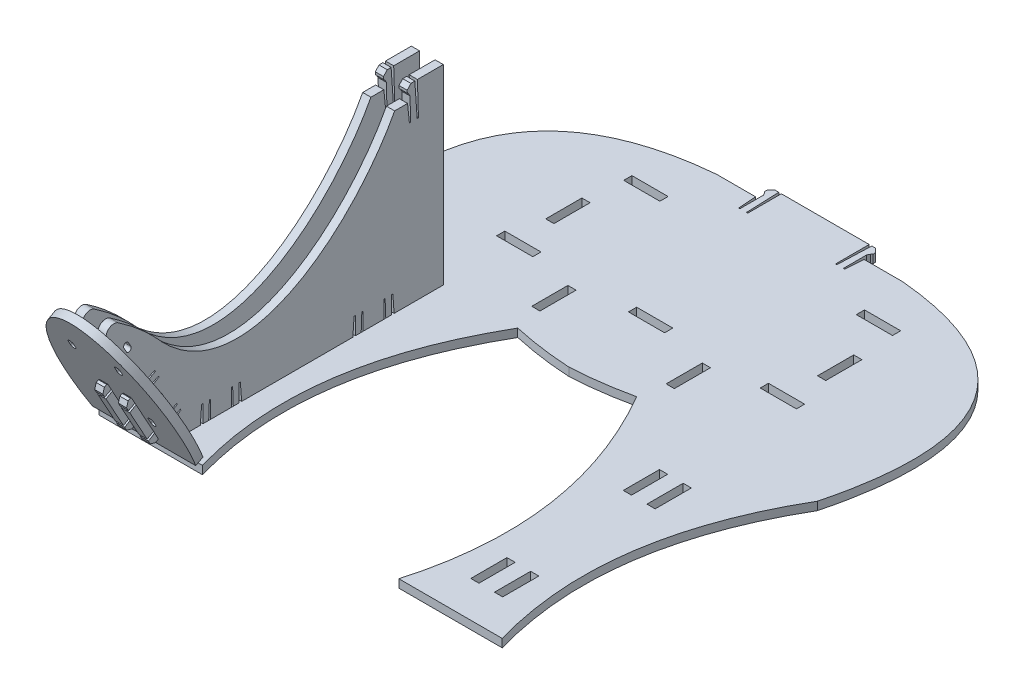
from build123d import *

# Parameters (mm, degrees)
SKETCH1_W           = 3.175
SKETCH1_H           = 14
SKETCH1_W_2         = 14
SKETCH1_H_2         = 3.175
BOSS_EXTRUDE4_DEPTH = 3.175
BOSS_EXTRUDE5_DEPTH = 3.175
SKETCH3_W           = 3.175
SKETCH3_H           = 20
BOSS_EXTRUDE6_DEPTH = 3.175


with BuildPart() as part:
    # Sketch1 → Boss-Extrude4 (new body)
    with BuildSketch(Plane(origin=(0, 0, 0), x_dir=(1, 0, 0), z_dir=(0, 1, 0))):
        with BuildLine():
            Line((-60.25, -196.531932239), (-20.25, -196.531932239))
            add(Edge.make_bspline(
                [(-5.25, -89.531932239), (-35.903052358, -142.206802127), (-20.25, -196.531932239)],
                knots=[0, 0, 0, 1, 1, 1], degree=2))
            add(Edge.make_bspline(
                [(-5.25, -89.531932239), (6.117224367, -92.06993647), (17.75, -92.706932239)],
                knots=[0, 0, 0, 1, 1, 1], degree=2))
            Line((17.75, -92.706932239), (17.75, -62.706932239))
            Line((17.75, -62.706932239), (10.75, -62.706932239))
            Line((10.75, -62.706932239), (10.75, -59.531932239))
            Line((10.75, -59.531932239), (17.75, -59.531932239))
            Line((17.75, -59.531932239), (17.75, 6.468067761))
            Line((17.75, 6.468067761), (0.75, 6.468067761))
            Line((0.75, 6.468067761), (0.75, -6.531932239))
            Line((0.75, -6.531932239), (0.25, -6.531932239))
            Line((0.25, -6.531932239), (-0.25, 6.468067761))
            Line((-0.25, 6.468067761), (-1.75, 6.468067761))
            Line((-1.75, 6.468067761), (-3.25, 4.968067761))
            Line((-3.25, 4.968067761), (-3.25, 3.968067761))
            Line((-3.25, 3.968067761), (-2.75, 3.468067761))
            Line((-2.75, 3.468067761), (-2.25, 2.468067761))
            Line((-2.25, 2.468067761), (-2.25, -6.531932239))
            Line((-2.25, -6.531932239), (-2.75, -6.531932239))
            Line((-2.75, -6.531932239), (-3.25, 0.468067761))
            Line((-3.25, 0.468067761), (-18.25, 0.468067761))
            add(Edge.make_bspline(
                [(-18.25, 0.468067761), (-96.860906479, -6.553326093), (-75.25, -89.531932239)],
                knots=[0, 0, 0, 1, 1, 1], degree=2))
            add(Edge.make_bspline(
                [(-75.25, -89.531932239), (-44.596947642, -142.206802127), (-60.25, -196.531932239)],
                knots=[0, 0, 0, 1, 1, 1], degree=2))
        make_face()
        with Locations((-44.8375, -175.531932239)):
            Rectangle(SKETCH1_W, SKETCH1_H, mode=Mode.SUBTRACT)
        with Locations((-44.8375, -116.531932239)):
            Rectangle(SKETCH1_W, SKETCH1_H, mode=Mode.SUBTRACT)
        with Locations((-35.6625, -175.531932239)):
            Rectangle(SKETCH1_W, SKETCH1_H, mode=Mode.SUBTRACT)
        with Locations((-35.6625, -116.531932239)):
            Rectangle(SKETCH1_W, SKETCH1_H, mode=Mode.SUBTRACT)
        with Locations((-33.25, -61.119432239)):
            Rectangle(SKETCH1_W_2, SKETCH1_H_2, mode=Mode.SUBTRACT)
        with Locations((-8.25, -72.531932239)):
            Rectangle(SKETCH1_W, SKETCH1_H, mode=Mode.SUBTRACT)
        with Locations((-34.8375, -40.531932239)):
            Rectangle(SKETCH1_W, SKETCH1_H, mode=Mode.SUBTRACT)
        with Locations((-27.25, -17.944432239)):
            Rectangle(SKETCH1_W_2, SKETCH1_H_2, mode=Mode.SUBTRACT)
    boss_extrude4 = extrude(amount=BOSS_EXTRUDE4_DEPTH)

    # Mirror1: Boss-Extrude4 across plane
    add(boss_extrude4.mirror(Plane(origin=(17.75, 3.175, 0), x_dir=(0, 0, 1), z_dir=(1, 0, 0))))

    # Sketch2 → Boss-Extrude5 (add)
    with BuildSketch(Plane(origin=(-37.25, 0, 0), x_dir=(0, 0, -1), z_dir=(1, 0, 0))):
        with BuildLine():
            Line((-168.031932239, 9.947707686), (-167.531932239, 2.947707686))
            Line((-167.531932239, 2.947707686), (-124.531932239, 2.947707686))
            Line((-124.531932239, 2.947707686), (-124.031932239, 9.947707686))
            Line((-124.031932239, 9.947707686), (-123.531932239, 9.947707686))
            Line((-123.531932239, 9.947707686), (-123.531932239, 0.947707686))
            Line((-123.531932239, 0.947707686), (-124.031932239, -0.052292314))
            Line((-124.031932239, -0.052292314), (-124.531932239, -0.552292314))
            Line((-124.531932239, -0.552292314), (-124.531932239, -1.552292314))
            Line((-124.531932239, -1.552292314), (-123.031932239, -3.052292314))
            Line((-123.031932239, -3.052292314), (-121.531932239, -3.052292314))
            Line((-121.531932239, -3.052292314), (-121.031932239, 9.947707686))
            Line((-121.031932239, 9.947707686), (-120.531932239, 9.947707686))
            Line((-120.531932239, 9.947707686), (-120.531932239, -3.052292314))
            Line((-120.531932239, -3.052292314), (-112.531932239, -3.052292314))
            Line((-112.531932239, -3.052292314), (-112.531932239, 9.947707686))
            Line((-112.531932239, 9.947707686), (-112.031932239, 9.947707686))
            Line((-112.031932239, 9.947707686), (-111.531932239, -3.052292314))
            Line((-111.531932239, -3.052292314), (-110.031932239, -3.052292314))
            Line((-110.031932239, -3.052292314), (-108.531932239, -1.552292314))
            Line((-108.531932239, -1.552292314), (-108.531932239, -0.552292314))
            Line((-108.531932239, -0.552292314), (-109.031932239, -0.052292314))
            Line((-109.031932239, -0.052292314), (-109.531932239, 0.947707686))
            Line((-109.531932239, 0.947707686), (-109.531932239, 9.947707686))
            Line((-109.531932239, 9.947707686), (-109.031932239, 9.947707686))
            Line((-109.031932239, 9.947707686), (-108.531932239, 2.947707686))
            Line((-108.531932239, 2.947707686), (-89.531932239, 2.947707686))
            Line((-89.531932239, 2.947707686), (-89.531932239, 77.068386058))
            Line((-89.531932239, 77.068386058), (-99.531932239, 77.068386058))
            Line((-99.531932239, 77.068386058), (-99.13042484, 64.074587852))
            Line((-99.13042484, 64.074587852), (-99.63018631, 64.05914526))
            Line((-99.63018631, 64.05914526), (-100.531455178, 77.037500873))
            Line((-100.531455178, 77.037500873), (-102.030739587, 76.991173097))
            Line((-102.030739587, 76.991173097), (-103.483696218, 75.445560911))
            Line((-103.483696218, 75.445560911), (-103.452811034, 74.446037972))
            Line((-103.452811034, 74.446037972), (-102.937606972, 73.961719095))
            Line((-102.937606972, 73.961719095), (-102.406960318, 72.977638749))
            Line((-102.406960318, 72.977638749), (-102.128993657, 63.981932299))
            Line((-102.128993657, 63.981932299), (-102.628755126, 63.966489706))
            Line((-102.628755126, 63.966489706), (-103.344712888, 70.947707686))
            Line((-103.344712888, 70.947707686), (-108.344712888, 70.947707686))
            add(Edge.make_bspline(
                [(-198.599597373, 38.725566491), (-197.888194247, 37.987012988), (-197.157746504, 37.266958954), (-195.474359274, 35.699025809), (-194.514490519, 34.86649604), (-191.549450932, 32.490608869), (-189.459436763, 31.068113156), (-186.674310402, 29.535879324), (-186.10860856, 29.241792573), (-184.958870111, 28.67973745), (-184.377764987, 28.413271713), (-182.624875508, 27.662264786), (-181.439701283, 27.224219665), (-177.83395229, 26.099785562), (-175.36322146, 25.602832477), (-172.188712427, 25.306817724), (-171.547898285, 25.263896148), (-170.271869843, 25.211258201), (-169.635350259, 25.20133489), (-167.730088908, 25.218705936), (-166.465639202, 25.293082726), (-163.947334459, 25.558056182), (-162.693480359, 25.748663118), (-160.195674397, 26.238501116), (-158.947936654, 26.539142022), (-155.276854139, 27.576416589), (-152.907665948, 28.449298662), (-148.294725494, 30.485980073), (-146.051191792, 31.650286311), (-142.766283954, 33.58319646), (-141.683658533, 34.259698129), (-139.565638309, 35.656319045), (-138.527315108, 36.37806458), (-135.468967935, 38.607445652), (-133.505244239, 40.17886071), (-129.708941557, 43.470257532), (-127.876459887, 45.190349541), (-124.333031294, 48.768213659), (-122.622100373, 50.626003898), (-120.14533688, 53.514229478), (-119.335238049, 54.493537029), (-117.756271833, 56.472469865), (-116.985960016, 57.473747581), (-114.73272482, 60.513129446), (-113.307044632, 62.586500722), (-110.678240251, 66.740882924), (-109.467766296, 68.817365715), (-108.344712888, 70.947707686)],
                knots=[0.006162439, 0.006162439, 0.006162439, 0.006162439, 0.03125, 0.03125, 0.0625, 0.0625, 0.125, 0.125, 0.140625, 0.140625, 0.15625, 0.15625, 0.1875, 0.1875, 0.25, 0.25, 0.265625, 0.265625, 0.28125, 0.28125, 0.3125, 0.3125, 0.34375, 0.34375, 0.375, 0.375, 0.4375, 0.4375, 0.5, 0.5, 0.53125, 0.53125, 0.5625, 0.5625, 0.625, 0.625, 0.6875, 0.6875, 0.75, 0.75, 0.78125, 0.78125, 0.8125, 0.8125, 0.875, 0.875, 0.934758476, 0.934758476, 0.934758476, 0.934758476], degree=3))
            Line((-198.599597373, 38.725566491), (-199.225401874, 39.505546443))
            add(Edge.make_bspline(
                [(-199.225401874, 39.505546443), (-201.572227389, 42.070046043), (-204.054501679, 44.508157738), (-208.002715367, 47.955561216), (-209.356443448, 49.069557919), (-211.44856048, 50.683143783), (-212.157370653, 51.212220561), (-213.587402604, 52.243624761), (-214.309280008, 52.746516242), (-215.145191316, 53.30811103), (-215.252321356, 53.379704192), (-215.359602423, 53.451015377)],
                knots=[0, 0, 0, 0, 0.25, 0.25, 0.375, 0.375, 0.4375, 0.4375, 0.5, 0.5, 0.509172688, 0.509172688, 0.509172688, 0.509172688], degree=3))
            ThreePointArc((-215.359602423, 53.451015377), (-219.051090923, 53.160777528), (-219.648744447, 49.506446452))
            Line((-219.648744447, 49.506446452), (-207.529502502, 27.479637839))
            Line((-207.529502502, 27.479637839), (-201.155491923, 30.415960223))
            Line((-201.155491923, 30.415960223), (-200.914463883, 29.977890042))
            Line((-200.914463883, 29.977890042), (-208.799727146, 25.639385315))
            Line((-208.799727146, 25.639385315), (-209.916895549, 25.595399415))
            Line((-209.916895549, 25.595399415), (-210.595993771, 25.792441556))
            Line((-210.595993771, 25.792441556), (-211.472134133, 25.310385476))
            Line((-211.472134133, 25.310385476), (-212.063260556, 23.27309081))
            Line((-212.063260556, 23.27309081), (-211.340176435, 21.958880267))
            Line((-211.340176435, 21.958880267), (-199.709323681, 27.787539136))
            Line((-199.709323681, 27.787539136), (-199.46829564, 27.349468954))
            Line((-199.46829564, 27.349468954), (-210.858120354, 21.082739904))
            Line((-210.858120354, 21.082739904), (-204.109335223, 8.816774828))
            Line((-204.109335223, 8.816774828), (-192.719510509, 15.083503878))
            Line((-192.719510509, 15.083503878), (-192.478482469, 14.645433697))
            Line((-192.478482469, 14.645433697), (-203.627279142, 7.940634465))
            Line((-203.627279142, 7.940634465), (-202.904195021, 6.626423921))
            Line((-202.904195021, 6.626423921), (-200.866900356, 6.035297498))
            Line((-200.866900356, 6.035297498), (-199.990759993, 6.517353579))
            Line((-199.990759993, 6.517353579), (-199.793717852, 7.196451801))
            Line((-199.793717852, 7.196451801), (-199.15860553, 8.116578063))
            Line((-199.15860553, 8.116578063), (-191.273342267, 12.45508279))
            Line((-191.273342267, 12.45508279), (-191.032314226, 12.017012609))
            Line((-191.032314226, 12.017012609), (-196.924268724, 8.204549862))
            Line((-196.924268724, 8.204549862), (-194.031932239, 2.947707686))
            Line((-194.031932239, 2.947707686), (-183.531932239, 2.947707686))
            Line((-183.531932239, 2.947707686), (-183.031932239, 9.947707686))
            Line((-183.031932239, 9.947707686), (-182.531932239, 9.947707686))
            Line((-182.531932239, 9.947707686), (-182.531932239, 0.947707686))
            Line((-182.531932239, 0.947707686), (-183.031932239, -0.052292314))
            Line((-183.031932239, -0.052292314), (-183.531932239, -0.552292314))
            Line((-183.531932239, -0.552292314), (-183.531932239, -1.552292314))
            Line((-183.531932239, -1.552292314), (-182.031932239, -3.052292314))
            Line((-182.031932239, -3.052292314), (-180.531932239, -3.052292314))
            Line((-180.531932239, -3.052292314), (-180.031932239, 9.947707686))
            Line((-180.031932239, 9.947707686), (-179.531932239, 9.947707686))
            Line((-179.531932239, 9.947707686), (-179.531932239, -3.052292314))
            Line((-179.531932239, -3.052292314), (-171.531932239, -3.052292314))
            Line((-171.531932239, -3.052292314), (-171.531932239, 9.947707686))
            Line((-171.531932239, 9.947707686), (-171.031932239, 9.947707686))
            Line((-171.031932239, 9.947707686), (-170.531932239, -3.052292314))
            Line((-170.531932239, -3.052292314), (-169.031932239, -3.052292314))
            Line((-169.031932239, -3.052292314), (-167.531932239, -1.552292314))
            Line((-167.531932239, -1.552292314), (-167.531932239, -0.552292314))
            Line((-167.531932239, -0.552292314), (-168.031932239, -0.052292314))
            Line((-168.031932239, -0.052292314), (-168.531932239, 0.947707686))
            Line((-168.531932239, 0.947707686), (-168.531932239, 9.947707686))
            Line((-168.531932239, 9.947707686), (-168.031932239, 9.947707686))
        make_face()
        with BuildLine():
            ThreePointArc((-200.080520606, 20.164402455), (-199.686436324, 21.522598899), (-198.328239881, 21.128514617))
            Line((-198.328239881, 21.128514617), (-197.364127719, 19.376233892))
            ThreePointArc((-197.364127719, 19.376233892), (-197.758212001, 18.018037448), (-199.116408444, 18.41212173))
            Line((-199.116408444, 18.41212173), (-200.080520606, 20.164402455))
        make_face(mode=Mode.SUBTRACT)
        with BuildLine():
            ThreePointArc((-213.096034787, 43.820192246), (-212.701950505, 45.178388689), (-211.343754062, 44.784304407))
            Line((-211.343754062, 44.784304407), (-210.3796419, 43.032023682))
            ThreePointArc((-210.3796419, 43.032023682), (-210.773726182, 41.673827239), (-212.131922626, 42.06791152))
            Line((-212.131922626, 42.06791152), (-213.096034787, 43.820192246))
        make_face(mode=Mode.SUBTRACT)
    boss_extrude5 = extrude(amount=BOSS_EXTRUDE5_DEPTH)

    # Mirror2: Boss-Extrude5 across plane
    add(boss_extrude5.mirror(Plane(origin=(-40.25, 0, 0), x_dir=(0, 0, 1), z_dir=(1, 0, 0))))

    # Sketch3 → Boss-Extrude6 (add)
    with BuildSketch(Plane(origin=(0, -81.264169081, 147.698206499), x_dir=(1, 0, 0), z_dir=(1.3027382187838158e-15, -0.4820560807919113, 0.8761403625969657))):
        with BuildLine():
            add(Edge.make_bspline(
                [(-21.77009646, 97.715467268), (-21.437662182, 99.095137672), (-21.151102831, 100.48309112), (-20.377737217, 104.881902099), (-20.042309166, 107.920092043), (-19.850525614, 111.758906488), (-19.823723507, 112.528532207), (-19.793257942, 114.06291515), (-19.789529166, 114.828799632), (-19.812459898, 117.122576979), (-19.873146048, 118.64660402), (-20.191561331, 123.20319341), (-20.583805051, 126.220473328), (-21.471692544, 130.712364009), (-21.817969159, 132.20394463), (-22.421863615, 134.431717697), (-22.637437901, 135.172982294), (-23.095691069, 136.642032557), (-23.338675597, 137.371034072), (-24.111710076, 139.540468486), (-24.685439036, 140.963491439), (-25.649299644, 143.056864774), (-25.987883021, 143.747761698), (-26.703771724, 145.114121427), (-27.080400302, 145.788041114), (-28.262735036, 147.762192952), (-29.123045107, 149.021842973), (-31.030969907, 151.394464889), (-32.076565296, 152.509018127), (-33.560412426, 153.763716318), (-33.865992369, 154.00714777), (-34.488480098, 154.470946775), (-34.806376129, 154.692179384), (-35.782007125, 155.32069128), (-36.461434941, 155.693185608), (-37.893613987, 156.32059856), (-38.626029644, 156.566129959), (-39.750735851, 156.82029297), (-40.130053934, 156.885971546), (-40.898109214, 156.976712255), (-41.289132144, 157.001762166), (-42.460862337, 157.011487508), (-43.228984503, 156.931931081), (-44.363278092, 156.694478777), (-44.738387862, 156.595598922), (-45.482835553, 156.359730207), (-45.849343298, 156.223494529), (-46.919671074, 155.77068518), (-47.600630029, 155.408425952), (-48.58231499, 154.791384061), (-48.902871166, 154.573341649), (-49.531713077, 154.114522822), (-49.839171058, 153.87425067), (-51.329568265, 152.63705929), (-52.391295091, 151.524027578), (-53.851019979, 149.729054345), (-54.315950471, 149.107619395), (-55.20070799, 147.834458631), (-55.618505058, 147.185951959), (-56.808988517, 145.209911024), (-57.519354758, 143.852140918), (-58.807707596, 141.072374133), (-59.385310802, 139.650191443), (-60.165522464, 137.475099117), (-60.411579097, 136.741605246), (-60.873800431, 135.269154016), (-61.089880926, 134.530721839), (-61.696189075, 132.309269123), (-62.044660345, 130.820118377), (-62.939809729, 126.33060599), (-63.337785816, 123.308413574), (-63.663159195, 118.735253023), (-63.725900929, 117.20415465), (-63.751153375, 114.897397811), (-63.748035388, 114.125594527), (-63.718660343, 112.585933217), (-63.692450172, 111.817982428), (-63.504096138, 107.987577231), (-63.172057899, 104.952840297), (-62.399110426, 100.530972623), (-62.108460994, 99.119327697), (-61.77009646, 97.715467268)],
                knots=[0.033462243, 0.033462243, 0.033462243, 0.033462243, 0.0625, 0.0625, 0.125, 0.125, 0.140625, 0.140625, 0.15625, 0.15625, 0.1875, 0.1875, 0.25, 0.25, 0.28125, 0.28125, 0.296875, 0.296875, 0.3125, 0.3125, 0.34375, 0.34375, 0.359375, 0.359375, 0.375, 0.375, 0.40625, 0.40625, 0.4375, 0.4375, 0.4453125, 0.4453125, 0.453125, 0.453125, 0.46875, 0.46875, 0.484375, 0.484375, 0.4921875, 0.4921875, 0.5, 0.5, 0.515625, 0.515625, 0.5234375, 0.5234375, 0.53125, 0.53125, 0.546875, 0.546875, 0.5546875, 0.5546875, 0.5625, 0.5625, 0.59375, 0.59375, 0.609375, 0.609375, 0.625, 0.625, 0.65625, 0.65625, 0.6875, 0.6875, 0.703125, 0.703125, 0.71875, 0.71875, 0.75, 0.75, 0.8125, 0.8125, 0.84375, 0.84375, 0.859375, 0.859375, 0.875, 0.875, 0.9375, 0.9375, 0.967022231, 0.967022231, 0.967022231, 0.967022231], degree=3))
            Line((-61.77009646, 97.715467268), (-21.77009646, 97.715467268))
        make_face()
        with BuildLine():
            Line((-50.25, 112.089080252), (-50.25, 114.089080252))
            ThreePointArc((-50.25, 114.089080252), (-49.25, 115.089080252), (-48.25, 114.089080252))
            Line((-48.25, 114.089080252), (-48.25, 112.089080252))
            ThreePointArc((-48.25, 112.089080252), (-49.25, 111.089080252), (-50.25, 112.089080252))
        make_face(mode=Mode.SUBTRACT)
        with Locations((-44.8375, 113.116878485)):
            Rectangle(SKETCH3_W, SKETCH3_H, mode=Mode.SUBTRACT)
        with Locations((-35.6625, 113.116878485)):
            Rectangle(SKETCH3_W, SKETCH3_H, mode=Mode.SUBTRACT)
        with BuildLine():
            ThreePointArc((-32.25, 114.089080252), (-31.25, 115.089080252), (-30.25, 114.089080252))
            Line((-30.25, 114.089080252), (-30.25, 112.089080252))
            ThreePointArc((-30.25, 112.089080252), (-31.25, 111.089080252), (-32.25, 112.089080252))
            Line((-32.25, 112.089080252), (-32.25, 114.089080252))
        make_face(mode=Mode.SUBTRACT)
        with BuildLine():
            Line((-50.25, 139.089080252), (-50.25, 141.089080252))
            ThreePointArc((-50.25, 141.089080252), (-49.25, 142.089080252), (-48.25, 141.089080252))
            Line((-48.25, 141.089080252), (-48.25, 139.089080252))
            ThreePointArc((-48.25, 139.089080252), (-49.25, 138.089080252), (-50.25, 139.089080252))
        make_face(mode=Mode.SUBTRACT)
        with BuildLine():
            ThreePointArc((-32.25, 141.089080252), (-31.25, 142.089080252), (-30.25, 141.089080252))
            Line((-30.25, 141.089080252), (-30.25, 139.089080252))
            ThreePointArc((-30.25, 139.089080252), (-31.25, 138.089080252), (-32.25, 139.089080252))
            Line((-32.25, 139.089080252), (-32.25, 141.089080252))
        make_face(mode=Mode.SUBTRACT)
    extrude(amount=BOSS_EXTRUDE6_DEPTH)


solid = part.part
